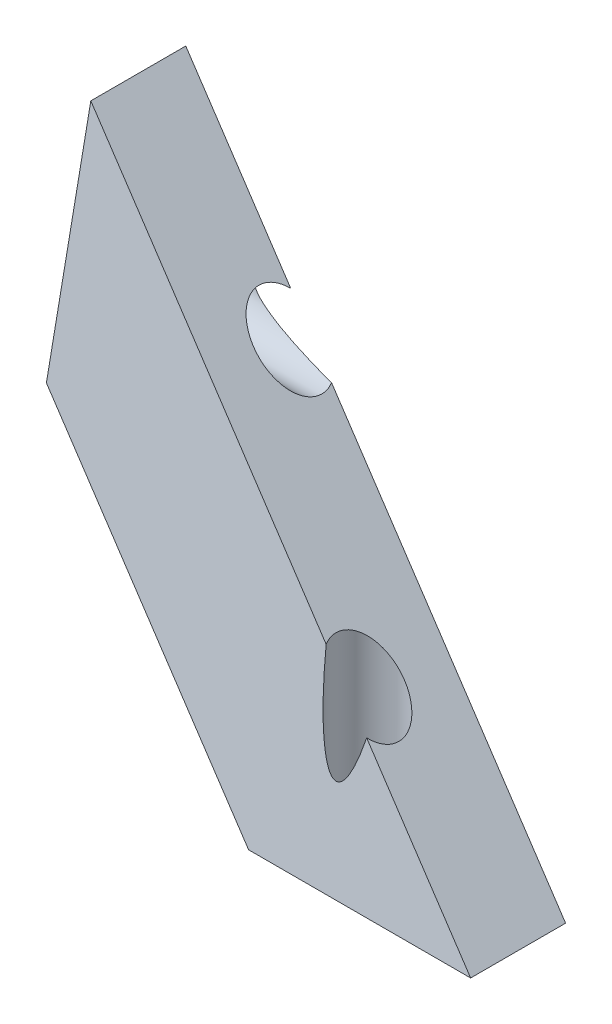
from build123d import *

# Parameters (mm, degrees)
SKETCH2_W               = 63.5
SKETCH2_H               = 25.4
BOSS_EXTRUDE1_DEPTH     = 63.5
CUT_EXTRUDE1_DEPTH      = 90.356423253
SKETCH4_W               = 4.2
SKETCH4_H               = 4.2
BOSS_EXTRUDE2_DEPTH     = 3.5
SKETCH5_W               = 4.2
SKETCH5_H               = 4.2
BOSS_EXTRUDE3_DEPTH     = 3.5
FILLET1_R               = 1.5
CUT_EXTRUDE4_DEPTH      = 93.517057968
CUT_EXTRUDE5_DEPTH      = 91.824676174
SKETCH8_R               = 2.385
CUT_EXTRUDE6_DEPTH      = 94.305261385
CUT_EXTRUDE7_DEPTH      = 10
CUT_EXTRUDE7_DEPTH_BACK = 18
SKETCH12_R              = 4.2
SKETCH13_R              = 2.385
CUT_EXTRUDE8_DEPTH      = 95.953441302
CUT_EXTRUDE9_DEPTH      = 20
CUT_EXTRUDE9_DEPTH_BACK = 10
SKETCH14_R              = 4.2
SKETCH15_W              = 71.848813027
SKETCH15_H              = 26.708799916
CUT_EXTRUDE10_DEPTH     = 30


with BuildPart() as part:
    # Sketch2 → Boss-Extrude1 (new body)
    with BuildSketch(Plane(origin=(0, 0, 0), x_dir=(1, 0, 0), z_dir=(0, 1, 0))):
        with Locations((-25.757915773, -9.546483207)):
            Rectangle(SKETCH2_W, SKETCH2_H)
    extrude(amount=BOSS_EXTRUDE1_DEPTH)

    # Sketch3 → Cut-Extrude1 (cut, through all)
    with BuildSketch(Plane.XY.offset(22.246483207)):
        Polygon((-57.507915773, 63.5), (5.992084227, 0), (5.992084227, 63.5), align=None)
    extrude(amount=-CUT_EXTRUDE1_DEPTH, mode=Mode.SUBTRACT)

    # Sketch4 → Boss-Extrude2 (add)
    with BuildSketch(Plane.XZ):
        with Locations((-52.407915773, 15.746483207)):
            Rectangle(SKETCH4_W, SKETCH4_H)
        with Locations((-39.707915773, 15.746483207)):
            Rectangle(SKETCH4_W, SKETCH4_H)
        with Locations((-27.007915773, 15.746483207)):
            Rectangle(SKETCH4_W, SKETCH4_H)
        with Locations((-14.307915773, 15.746483207)):
            Rectangle(SKETCH4_W, SKETCH4_H)
        with Locations((-1.607915773, 15.746483207)):
            Rectangle(SKETCH4_W, SKETCH4_H)
    extrude(amount=BOSS_EXTRUDE2_DEPTH)

    # Sketch5 → Boss-Extrude3 (add)
    with BuildSketch(Plane.ZY.offset(57.507915773)):
        with Locations((3.346483207, 5.5)):
            Rectangle(SKETCH5_W, SKETCH5_H)
        with Locations((3.346483207, 18)):
            Rectangle(SKETCH5_W, SKETCH5_H)
        with Locations((3.346483207, 30.5)):
            Rectangle(SKETCH5_W, SKETCH5_H)
        with Locations((3.346483207, 43)):
            Rectangle(SKETCH5_W, SKETCH5_H)
        with Locations((3.346483207, 55.5)):
            Rectangle(SKETCH5_W, SKETCH5_H)
    extrude(amount=BOSS_EXTRUDE3_DEPTH)

    # Fillet1
    fillet1_edges = [part.edges().sort_by_distance(p)[0] for p in [
        (-59.257915773, 28.4, 1.246483207),
        (-59.257915773, 28.4, 5.446483207),
        (-59.257915773, 32.6, 5.446483207),
        (-59.257915773, 32.6, 1.246483207),
        (-59.257915773, 40.9, 1.246483207),
        (-59.257915773, 40.9, 5.446483207),
        (-59.257915773, 45.1, 5.446483207),
        (-59.257915773, 45.1, 1.246483207),
        (-59.257915773, 53.4, 1.246483207),
        (-59.257915773, 53.4, 5.446483207),
        (-59.257915773, 57.6, 5.446483207),
        (-59.257915773, 57.6, 1.246483207),
        (-54.507915773, -1.75, 17.846483207),
        (-54.507915773, -1.75, 13.646483207),
        (-50.307915773, -1.75, 13.646483207),
        (-50.307915773, -1.75, 17.846483207),
        (-37.607915773, -1.75, 17.846483207),
        (-41.807915773, -1.75, 17.846483207),
        (-41.807915773, -1.75, 13.646483207),
        (-37.607915773, -1.75, 13.646483207),
        (-24.907915773, -1.75, 17.846483207),
        (-29.107915773, -1.75, 17.846483207),
        (-29.107915773, -1.75, 13.646483207),
        (-24.907915773, -1.75, 13.646483207),
        (-12.207915773, -1.75, 17.846483207),
        (-16.407915773, -1.75, 17.846483207),
        (-16.407915773, -1.75, 13.646483207),
        (-12.207915773, -1.75, 13.646483207),
        (0.492084227, -1.75, 17.846483207),
        (-3.707915773, -1.75, 17.846483207),
        (-3.707915773, -1.75, 13.646483207),
        (0.492084227, -1.75, 13.646483207),
        (-59.257915773, 7.6, 1.246483207),
        (-59.257915773, 3.4, 1.246483207),
        (-59.257915773, 3.4, 5.446483207),
        (-59.257915773, 7.6, 5.446483207),
        (-59.257915773, 15.9, 1.246483207),
        (-59.257915773, 15.9, 5.446483207),
        (-59.257915773, 20.1, 5.446483207),
        (-59.257915773, 20.1, 1.246483207),
    ]]
    fillet(fillet1_edges, radius=FILLET1_R)

    # Sketch6 → Cut-Extrude4 (cut, through all)
    with BuildSketch(Plane.ZY.offset(57.507915773)):
        Polygon((22.246483207, 0), (9.546483207, 63.5), (22.246483207, 63.5), align=None)
    extrude(amount=-CUT_EXTRUDE4_DEPTH, mode=Mode.SUBTRACT)

    # Sketch7 → Cut-Extrude5 (cut, through all)
    with BuildSketch(Plane.XZ):
        Polygon((-57.507915773, -3.153516793), (5.992084227, 9.546483207), (5.992084227, -3.153516793), align=None)
    extrude(amount=-CUT_EXTRUDE5_DEPTH, mode=Mode.SUBTRACT)

    # Sketch8 → Cut-Extrude6 (cut, through all)
    with BuildSketch(Plane.XZ.offset(3.5)):
        with Locations(Location((-14.307915773, 15.746483207, 0), (0, 0, 270))):
            Circle(SKETCH8_R)
    extrude(amount=-CUT_EXTRUDE6_DEPTH, mode=Mode.SUBTRACT)

    # Sketch12 → Cut-Extrude7 (cut, two sides: drawn at the far end of the back side and taken through both)
    with BuildSketch(Plane(origin=(0, 23.204147495, 0), x_dir=(1, 0, 0), z_dir=(0, 1, 0)).offset(-CUT_EXTRUDE7_DEPTH_BACK)):
        with Locations(Location((-14.307915773, -15.746483207, 0), (0, 0, 203.417331866))):
            Circle(SKETCH12_R)
    extrude(amount=CUT_EXTRUDE7_DEPTH + CUT_EXTRUDE7_DEPTH_BACK, mode=Mode.SUBTRACT)

    # Sketch13 → Cut-Extrude8 (cut, through all)
    with BuildSketch(Plane.ZY.offset(61.007915773)):
        with Locations(Location((3.346483207, 43, 0), (0, 0, 200.648098404))):
            Circle(SKETCH13_R)
    extrude(amount=-CUT_EXTRUDE8_DEPTH, mode=Mode.SUBTRACT)

    # Sketch14 → Cut-Extrude9 (cut, two sides: drawn at the far end of the back side and taken through both)
    with BuildSketch(Plane.ZY.offset(33.553145543).offset(-CUT_EXTRUDE9_DEPTH_BACK)):
        with Locations(Location((3.346483207, 43, 0), (0, 0, 135.388680518))):
            Circle(SKETCH14_R)
    extrude(amount=CUT_EXTRUDE9_DEPTH + CUT_EXTRUDE9_DEPTH_BACK, mode=Mode.SUBTRACT)

    # Sketch15 → Cut-Extrude10 (cut)
    with BuildSketch(Plane(origin=(-11.853200292, -11.853200292, 0), x_dir=(0.7071067811865475, -0.7071067811865477, 0), z_dir=(0.7071067811865477, 0.7071067811865475, 0))):
        with Locations((-41.881900269, -9.453152274)):
            Rectangle(SKETCH15_W, SKETCH15_H)
    extrude(amount=-CUT_EXTRUDE10_DEPTH, mode=Mode.SUBTRACT)


solid = part.part
